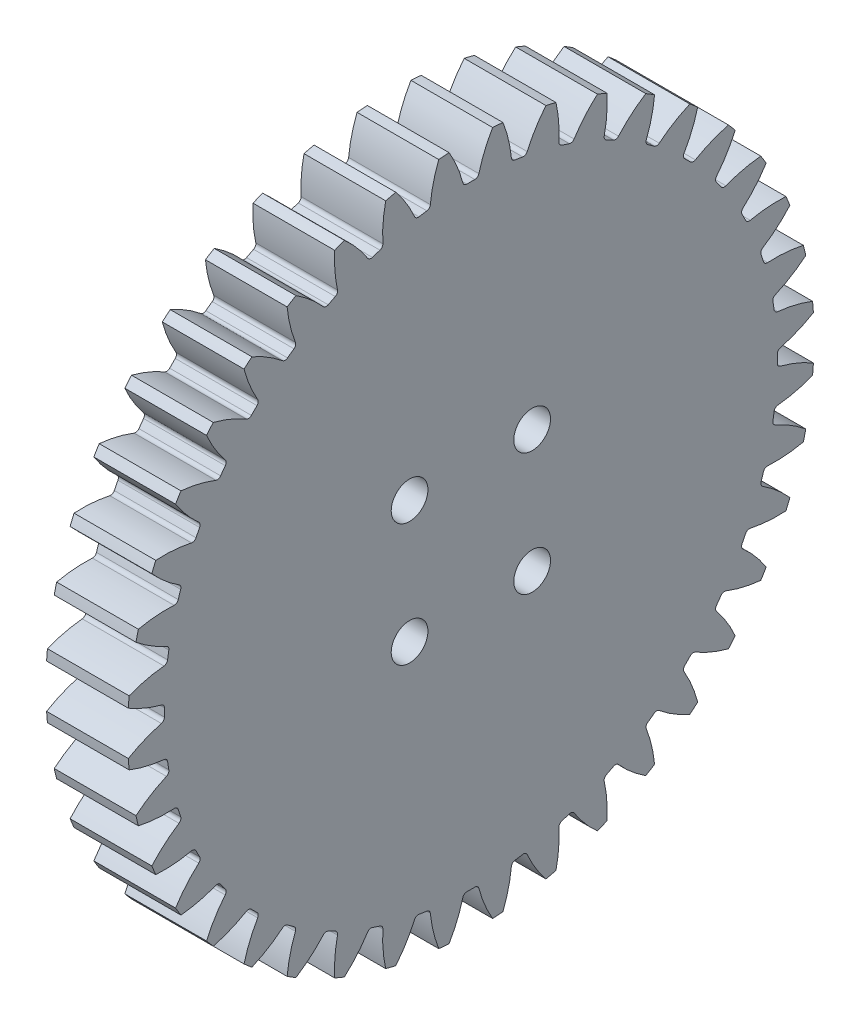
from build123d import *

# Parameters (mm, degrees)
BASPROSKE_W                = 10
BASPROSKE_H                = 42
TOOTHCUT_DEPTH             = 61.232881386
ROOTFILLETS_R              = 0.501
TEETHCUTS_COUNT            = 40
TEETHCUTS_ANGLE            = 351
ROOTFILLETS_OF_TEETHCUTS_R = 0.501
F_8_CLEARANCE_HOLE1_D      = 4.4958


with BuildPart() as part:
    # BasProSke → Base-Revolve (revolve)
    with BuildSketch(Plane(origin=(0, 0, 0), x_dir=(1, 0, 0), z_dir=(0, 1, 0)), mode=Mode.PRIVATE) as base_revolve_sk:
        with Locations((5, 21)):
            Rectangle(BASPROSKE_W, BASPROSKE_H)
    revolve(base_revolve_sk.sketch.rotate(Axis((-10, 0, 0), (1, 0, 0)), 180), axis=Axis((-10, 0, 0), (1, 0, 0)))

    # TooCutSke → ToothCut (cut, through all)
    with BuildSketch(Plane(origin=(0, 0, 0), x_dir=(0, 0, -1), z_dir=(1, 0, 0))):
        with BuildLine():
            ThreePointArc((0.882812088, 37.488606854), (0, 37.499), (-0.882812088, 37.488606854))
            ThreePointArc((-0.882812088, 37.488606854), (-1.612748684, 39.782000434), (-2.678427154, 41.939960338))
            ThreePointArc((-2.678427154, 41.939960338), (0, 42.0254), (2.678427154, 41.939960338))
            ThreePointArc((2.678427154, 41.939960338), (1.612748684, 39.782000434), (0.882812088, 37.488606854))
        make_face()
    toothcut = extrude(amount=TOOTHCUT_DEPTH, mode=Mode.SUBTRACT)

    # RootFillets
    rootfillets_edges = [part.edges().sort_by_distance(p)[0] for p in [
        (5, 37.488606854, -0.882812088),
        (5, 37.488606854, 0.882812088),
    ]]
    fillet(rootfillets_edges, radius=ROOTFILLETS_R)

    # TeethCuts: ToothCut ×40 about axis
    teethcuts_axis = Axis((-10, 0, 0), (1, 0, 0))
    for i in range(1, TEETHCUTS_COUNT):
        add(toothcut.rotate(teethcuts_axis, i * TEETHCUTS_ANGLE / (TEETHCUTS_COUNT - 1)), mode=Mode.SUBTRACT)

    # RootFillets of TeethCuts
    rootfillets_of_teethcuts_edges = [part.edges().sort_by_distance(p)[0] for p in [
        (5, 37.165162131, 4.992566952),
        (5, 36.888957658, 6.736453364),
        (5, 35.926587773, 10.745012425),
        (5, 35.380979897, 12.424220802),
        (5, 33.80338159, 16.23288003),
        (5, 33.001804988, 17.80606269),
        (5, 30.847823966, 21.321040256),
        (5, 29.810016114, 22.749460219),
        (5, 27.132690537, 25.88420571),
        (5, 25.88420571, 27.132690537),
        (5, 22.749460219, 29.810016114),
        (5, 21.321040256, 30.847823966),
        (5, 17.80606269, 33.001804988),
        (5, 16.23288003, 33.80338159),
        (5, 12.424220802, 35.380979897),
        (5, 10.745012425, 35.926587773),
        (5, 6.736453364, 36.888957658),
        (5, 4.992566952, 37.165162131),
        (5, 0.882812088, 37.488606854),
        (5, -0.882812088, 37.488606854),
        (5, -4.992566952, 37.165162131),
        (5, -6.736453364, 36.888957658),
        (5, -10.745012425, 35.926587773),
        (5, -12.424220802, 35.380979897),
        (5, -16.23288003, 33.80338159),
        (5, -17.80606269, 33.001804988),
        (5, -21.321040256, 30.847823966),
        (5, -22.749460219, 29.810016114),
        (5, -25.88420571, 27.132690537),
        (5, -27.132690537, 25.88420571),
        (5, -29.810016114, 22.749460219),
        (5, -30.847823966, 21.321040256),
        (5, -33.001804988, 17.80606269),
        (5, -33.80338159, 16.23288003),
        (5, -35.380979897, 12.424220802),
        (5, -35.926587773, 10.745012425),
        (5, -36.888957658, 6.736453364),
        (5, -37.165162131, 4.992566952),
        (5, -37.488606854, 0.882812088),
        (5, -37.488606854, -0.882812088),
        (5, -37.165162131, -4.992566952),
        (5, -36.888957658, -6.736453364),
        (5, -35.926587773, -10.745012425),
        (5, -35.380979897, -12.424220802),
        (5, -33.80338159, -16.23288003),
        (5, -33.001804988, -17.80606269),
        (5, -30.847823966, -21.321040256),
        (5, -29.810016114, -22.749460219),
        (5, -27.132690537, -25.88420571),
        (5, -25.88420571, -27.132690537),
        (5, -22.749460219, -29.810016114),
        (5, -21.321040256, -30.847823966),
        (5, -17.80606269, -33.001804988),
        (5, -16.23288003, -33.80338159),
        (5, -12.424220802, -35.380979897),
        (5, -10.745012425, -35.926587773),
        (5, -6.736453364, -36.888957658),
        (5, -4.992566952, -37.165162131),
        (5, -0.882812088, -37.488606854),
        (5, 0.882812088, -37.488606854),
        (5, 4.992566952, -37.165162131),
        (5, 6.736453364, -36.888957658),
        (5, 10.745012425, -35.926587773),
        (5, 12.424220802, -35.380979897),
        (5, 16.23288003, -33.80338159),
        (5, 17.80606269, -33.001804988),
        (5, 21.321040256, -30.847823966),
        (5, 22.749460219, -29.810016114),
        (5, 25.88420571, -27.132690537),
        (5, 27.132690537, -25.88420571),
        (5, 29.810016114, -22.749460219),
        (5, 30.847823966, -21.321040256),
        (5, 33.001804988, -17.80606269),
        (5, 33.80338159, -16.23288003),
        (5, 35.380979897, -12.424220802),
        (5, 35.926587773, -10.745012425),
        (5, 36.888957658, -6.736453364),
        (5, 37.165162131, -4.992566952),
    ]]
    fillet(rootfillets_of_teethcuts_edges, radius=ROOTFILLETS_OF_TEETHCUTS_R)

    # #8 Clearance Hole1 (through all)
    with Locations(Plane.ZY):
        with Locations((-7.5, 7.5), (7.5, 7.5), (-7.5, -7.5), (7.5, -7.5)):
            Hole(F_8_CLEARANCE_HOLE1_D / 2)


solid = part.part
